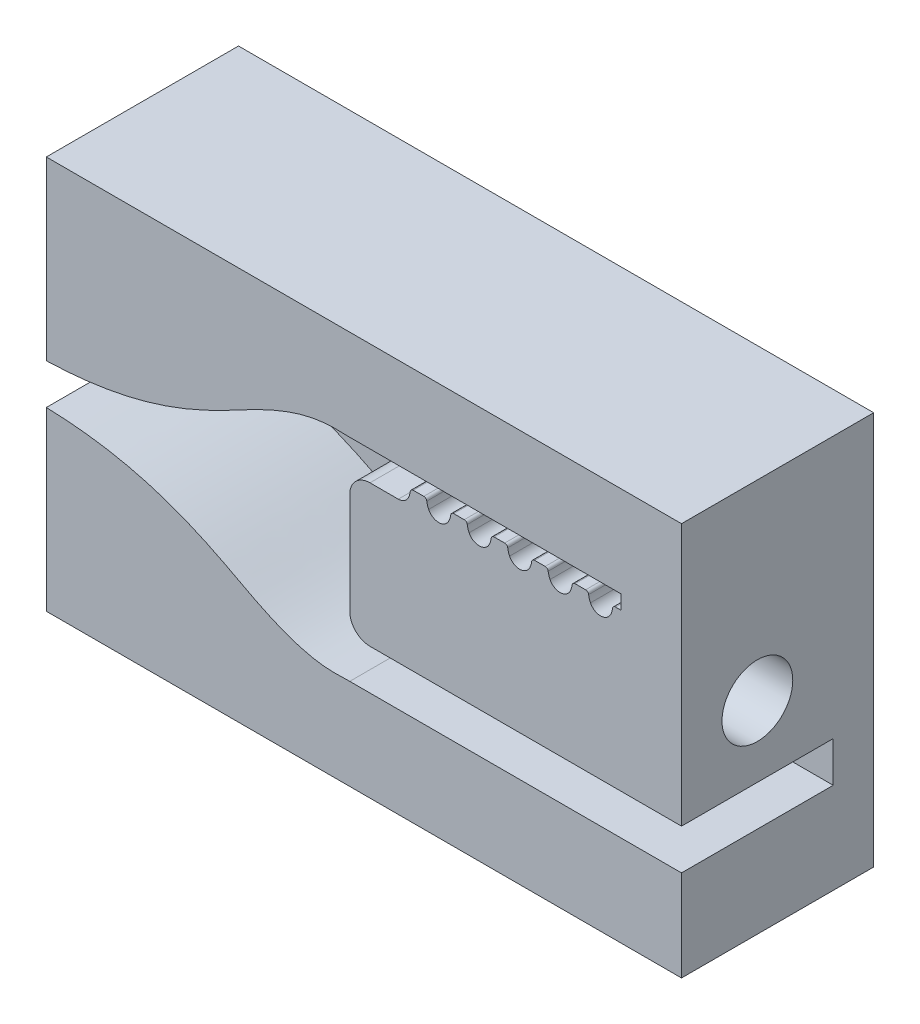
from build123d import *

# Parameters (mm, degrees)
ESTRUSIONE_ESTRUSIONE1_DEPTH   = 7.5
ESTRUSIONE_ESTRUSIONE1_2_DEPTH = 7.5
SCHIZZO2_W                     = 31.4
SCHIZZO2_H                     = 19.45
ESTRUSIONE_ESTRUSIONE2_DEPTH   = 2
TAGLIO_ESTRUSIONE3_DEPTH       = 2.4
SCHIZZO5_3_R                   = 1.75
TAGLIO_ESTRUSIONE4_DEPTH       = 27.523810222
RACCORDO1_R                    = 1


with BuildPart() as part:
    # Schizzo1 → Estrusione-Estrusione1 (new body)
    with BuildSketch(Plane.XY):
        with BuildLine():
            Line((31.4, 6.5), (31.4, 19.45))
            Line((31.4, 19.45), (0, 19.45))
            Line((0, 19.45), (0, 10.725))
            add(Edge.make_bspline(
                [(15, 14.95), (14.198625643, 14.95), (12.206107526, 15.352992529), (5.436685448, 10.879393873), (0, 10.725)],
                knots=[0, 0, 0, 0, 0.57277107, 1, 1, 1, 1], degree=3))
            Line((15, 14.95), (28.4, 14.95))
            Line((28.4, 14.95), (28.4, 14.25))
            Line((28.4, 14.25), (28.140175425, 14.25))
            ThreePointArc((28.140175425, 14.25), (28.041268354, 14.212771412), (27.991456891, 14.119565217))
            ThreePointArc((27.991456891, 14.119565217), (27.957611714, 13.961937846), (27.898876404, 13.811797753))
            ThreePointArc((27.898876404, 13.811797753), (27.4, 13.5), (26.901123596, 13.811797753))
            ThreePointArc((26.901123596, 13.811797753), (26.842388286, 13.961937846), (26.808543109, 14.119565217))
            ThreePointArc((26.808543109, 14.119565217), (26.758731646, 14.212771412), (26.659824575, 14.25))
            Line((26.659824575, 14.25), (26.140175425, 14.25))
            ThreePointArc((26.140175425, 14.25), (26.041268354, 14.212771412), (25.991456891, 14.119565217))
            ThreePointArc((25.991456891, 14.119565217), (25.957611714, 13.961937846), (25.898876404, 13.811797753))
            ThreePointArc((25.898876404, 13.811797753), (25.4, 13.5), (24.901123596, 13.811797753))
            ThreePointArc((24.901123596, 13.811797753), (24.842388286, 13.961937846), (24.808543109, 14.119565217))
            ThreePointArc((24.808543109, 14.119565217), (24.758731646, 14.212771412), (24.659824575, 14.25))
            Line((24.659824575, 14.25), (24.140175425, 14.25))
            ThreePointArc((24.140175425, 14.25), (24.041268354, 14.212771412), (23.991456891, 14.119565217))
            ThreePointArc((23.991456891, 14.119565217), (23.957611714, 13.961937846), (23.898876404, 13.811797753))
            ThreePointArc((23.898876404, 13.811797753), (23.4, 13.5), (22.901123596, 13.811797753))
            ThreePointArc((22.901123596, 13.811797753), (22.842388286, 13.961937846), (22.808543109, 14.119565217))
            ThreePointArc((22.808543109, 14.119565217), (22.758731646, 14.212771412), (22.659824575, 14.25))
            Line((22.659824575, 14.25), (22.140175425, 14.25))
            ThreePointArc((22.140175425, 14.25), (22.041268354, 14.212771412), (21.991456891, 14.119565217))
            ThreePointArc((21.991456891, 14.119565217), (21.957611714, 13.961937846), (21.898876404, 13.811797753))
            ThreePointArc((21.898876404, 13.811797753), (21.4, 13.5), (20.901123596, 13.811797753))
            ThreePointArc((20.901123596, 13.811797753), (20.842388286, 13.961937846), (20.808543109, 14.119565217))
            ThreePointArc((20.808543109, 14.119565217), (20.758731646, 14.212771412), (20.659824575, 14.25))
            Line((20.659824575, 14.25), (20.140175425, 14.25))
            ThreePointArc((20.140175425, 14.25), (20.041268354, 14.212771412), (19.991456891, 14.119565217))
            ThreePointArc((19.991456891, 14.119565217), (19.957611714, 13.961937846), (19.898876404, 13.811797753))
            ThreePointArc((19.898876404, 13.811797753), (19.4, 13.5), (18.901123596, 13.811797753))
            ThreePointArc((18.901123596, 13.811797753), (18.842388286, 13.961937846), (18.808543109, 14.119565217))
            ThreePointArc((18.808543109, 14.119565217), (18.758731646, 14.212771412), (18.659824575, 14.25))
            Line((18.659824575, 14.25), (18.140175425, 14.25))
            ThreePointArc((18.140175425, 14.25), (18.041268354, 14.212771412), (17.991456891, 14.119565217))
            ThreePointArc((17.991456891, 14.119565217), (17.957611714, 13.961937846), (17.898876404, 13.811797753))
            ThreePointArc((17.898876404, 13.811797753), (17.694149412, 13.584360941), (17.4, 13.5))
            Line((17.4, 13.5), (15, 13.5))
            Line((15, 13.5), (15, 6.5))
            Line((15, 6.5), (31.4, 6.5))
        make_face()
    extrude(amount=ESTRUSIONE_ESTRUSIONE1_DEPTH)



with BuildPart() as body_2:
    # Schizzo1 → Estrusione-Estrusione1 2 (new body)
    with BuildSketch(Plane.XY):
        with BuildLine():
            Line((31.4, 0), (31.4, 4.5))
            Line((31.4, 4.5), (15, 4.5))
            add(Edge.make_bspline(
                [(15, 4.5), (14.198625643, 4.5), (12.206107526, 4.097007471), (5.436685448, 8.570606127), (0, 8.725)],
                knots=[0, 0, 0, 0, 0.57277107, 1, 1, 1, 1], degree=3))
            Line((0, 8.725), (0, 0))
            Line((0, 0), (31.4, 0))
        make_face()
    extrude(amount=ESTRUSIONE_ESTRUSIONE1_2_DEPTH)


with BuildPart() as part_1:
    add(part.part)

    add(body_2.part)  # Estrusione-Estrusione2 merges body 2
    # Schizzo2 → Estrusione-Estrusione2 (add)
    with BuildSketch(Plane(origin=(0, 0, 0), x_dir=(-1, 0, 0), z_dir=(0, 0, -1))):
        with Locations((-15.7, 9.725)):
            Rectangle(SCHIZZO2_W, SCHIZZO2_H)
    extrude(amount=ESTRUSIONE_ESTRUSIONE2_DEPTH)

    # Schizzo5 → Taglio-Estrusione3 (cut)
    with BuildSketch(Plane.ZY.offset(-15)):
        Polygon((5.308845727, 7.1), (6.983161507, 10), (5.366580754, 12.8), (5.308845727, 12.9), (5.308845727, 13.5), (2.191154273, 13.5), (2.191154273, 12.9), (0.516838493, 10), (1.980206835, 7.46537168), (1.980206835, 7.2), (1.980206835, 6.5), (5.308845727, 6.5), align=None)
    extrude(amount=-TAGLIO_ESTRUSIONE3_DEPTH, mode=Mode.SUBTRACT)

    # Schizzo5<3> → Taglio-Estrusione4 (cut, through all)
    with BuildSketch(Plane.ZY.offset(-15)):
        with Locations((3.75, 10)):
            Circle(SCHIZZO5_3_R)
    extrude(amount=-TAGLIO_ESTRUSIONE4_DEPTH, mode=Mode.SUBTRACT)

    # Raccordo1
    raccordo1_edges = [part_1.edges().sort_by_distance(p)[0] for p in [
        (15, 13.5, 6.404422863),
        (15, 13.5, 1.095577137),
        (15, 6.5, 0.990103418),
        (15, 6.5, 6.404422863),
    ]]
    fillet(raccordo1_edges, radius=RACCORDO1_R)


solid = part_1.part
